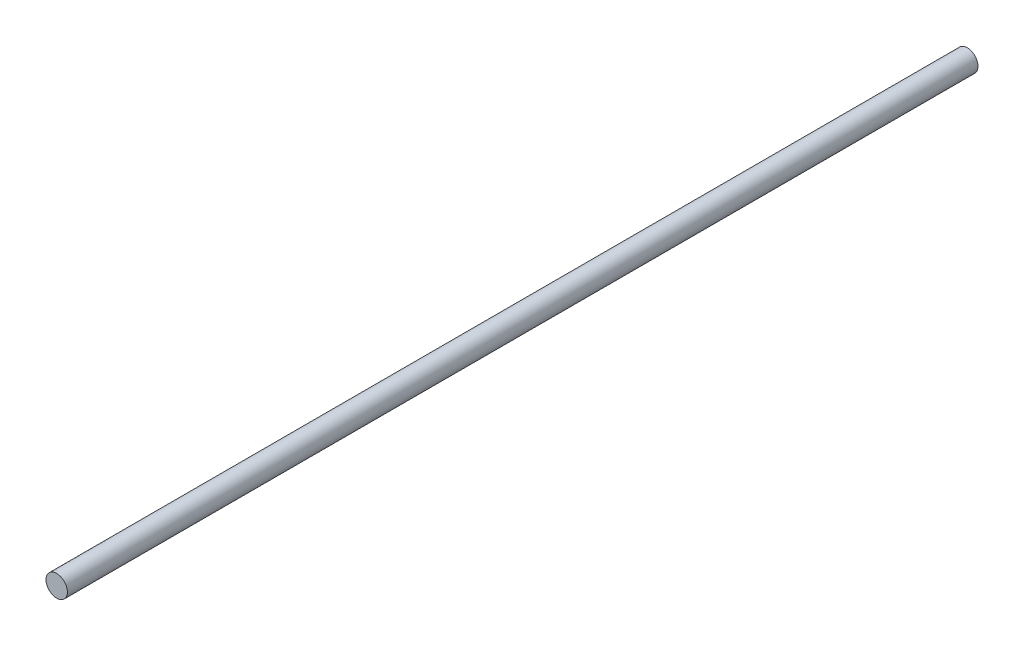
from build123d import *

# Parameters (mm, degrees)
SKETCH1_R           = 4
BOSS_EXTRUDE1_DEPTH = 339.6


with BuildPart() as part:
    # Sketch1 → Boss-Extrude1 (new body)
    with BuildSketch(Plane.XY):
        Circle(SKETCH1_R)
    extrude(amount=BOSS_EXTRUDE1_DEPTH)


solid = part.part
